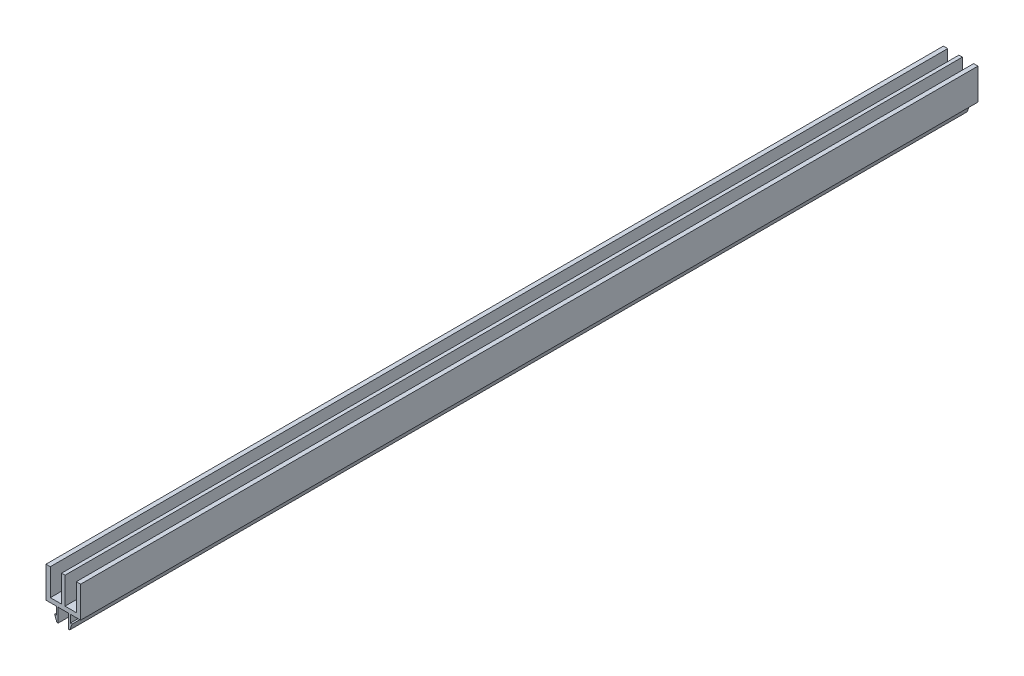
from build123d import *

# Parameters (mm, degrees)
BOSS_EXTRU_1_DEPTH = 518


with BuildPart() as part:
    # Esquisse1 → Boss.-Extru.1 (new body)
    with BuildSketch(Plane.XY.offset(50)):
        Polygon((-1, 2.5), (-7.5, 2.5), (-7.5, 17.999999998), (-10, 17.999999998), (-10, 0), (-4, 0), (-4, -4.5), (-5, -4.5), (-3.75, -8), (-3, -8), (-3, 0), (3, 0), (3, -8), (3.75, -8), (5, -4.5), (4, -4.5), (4, 0), (10, 0), (10, 17.999999998), (7.5, 17.999999998), (7.5, 2.5), (1, 2.5), (1, 17.999999998), (-1, 17.999999998), align=None)
    extrude(amount=-BOSS_EXTRU_1_DEPTH)


solid = part.part
